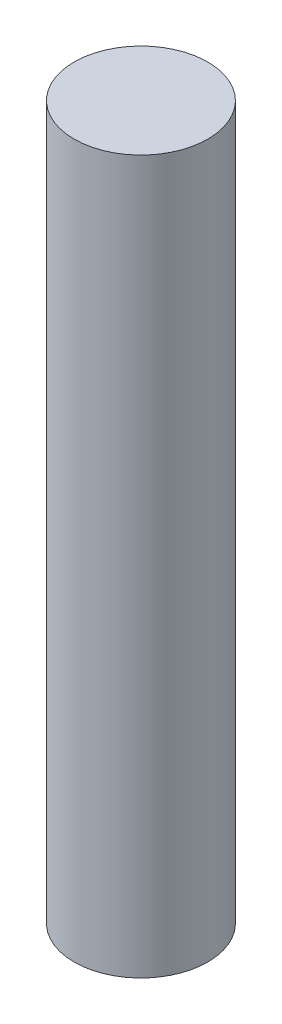
from build123d import *

# Parameters (mm, degrees)
SKETCH2_R           = 1.875
BOSS_EXTRUDE1_DEPTH = 20


with BuildPart() as part:
    # Sketch2 → Boss-Extrude1 (new body)
    with BuildSketch(Plane(origin=(0, 0, 0), x_dir=(1, 0, 0), z_dir=(0, 1, 0))):
        with Locations(Location((0, 0, 0), (0, 0, 270))):
            Circle(SKETCH2_R)
    extrude(amount=BOSS_EXTRUDE1_DEPTH)


solid = part.part
